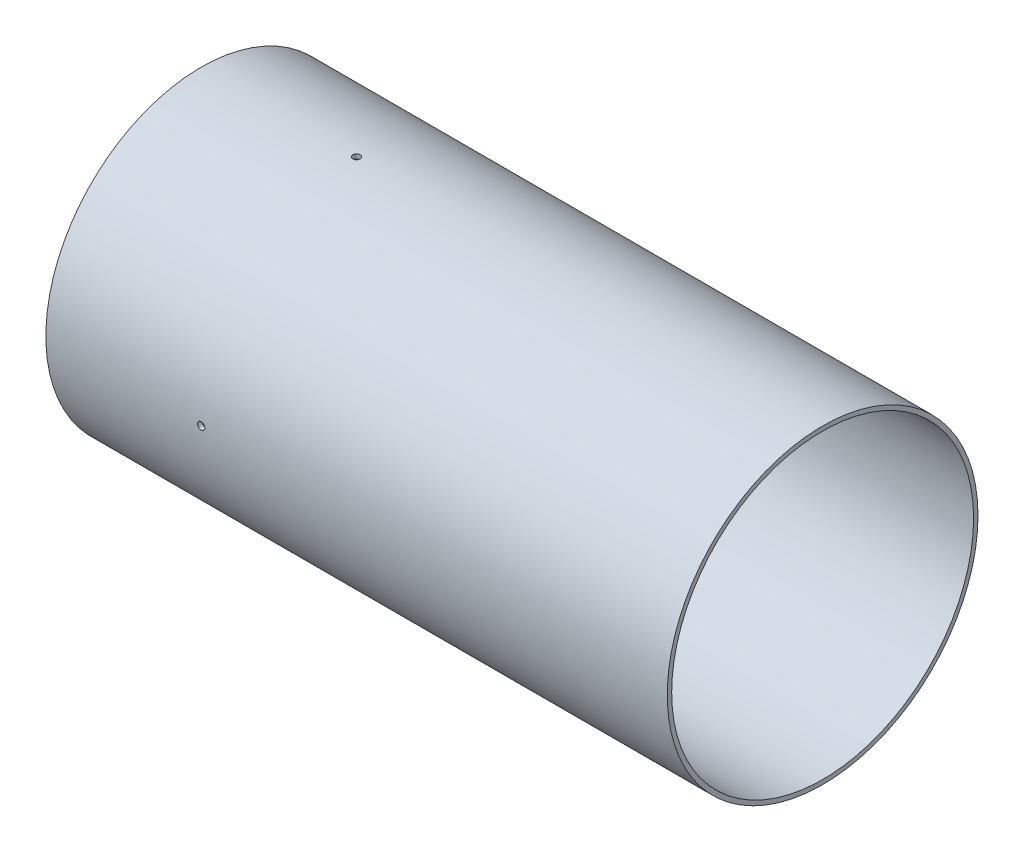
from build123d import *

# Parameters (mm, degrees)
SKETCH1_R               = 76.2
SKETCH1_R_2             = 74.041
BOSS_EXTRUDE1_DEPTH     = 304.8
CUT_EXTRUDE1_REACH      = 325.289
CUT_EXTRUDE1_END_RADIUS = 76.2
SKETCH2_R               = 1.7859375
CIRPATTERN1_COUNT       = 4


with BuildPart() as part:
    # Sketch1 → Boss-Extrude1 (new body)
    with BuildSketch(Plane(origin=(0, 0, 0), x_dir=(0, 0, -1), z_dir=(1, 0, 0))):
        with Locations(Location((0, 0, 0), (0, 0, 180))):
            Circle(SKETCH1_R)
        with Locations(Location((0, 0, 0), (0, 0, 180))):
            Circle(SKETCH1_R_2, mode=Mode.SUBTRACT)
    extrude(amount=BOSS_EXTRUDE1_DEPTH)

    # Cut-Extrude1: up to this cylinder (the profile starts inside it)
    cut_extrude1_end = Plane(origin=(76.2, 0, 0), z_dir=(-1, 0, 0)) * Cylinder(CUT_EXTRUDE1_END_RADIUS, 803.978, mode=Mode.PRIVATE)
    # Sketch2 → Cut-Extrude1 (cut, up to the surface)
    with BuildSketch(Plane.XY, mode=Mode.PRIVATE) as cut_extrude1_sk1:
        with Locations((76.2, 0)):
            Circle(SKETCH2_R)
    cut_extrude1_tool1 = extrude(cut_extrude1_sk1.sketch, amount=-CUT_EXTRUDE1_REACH, mode=Mode.PRIVATE) & cut_extrude1_end
    cut_extrude1 = cut_extrude1_tool1.solids().sort_by_distance((76.2, 0, 0))[0]
    add(cut_extrude1, mode=Mode.SUBTRACT)

    # CirPattern1: Cut-Extrude1 ×4 about axis
    cirpattern1_axis = Axis((0, 0, 0), (1, 0, 0))
    for i in range(1, CIRPATTERN1_COUNT):
        add(cut_extrude1.rotate(cirpattern1_axis, i * 360 / CIRPATTERN1_COUNT), mode=Mode.SUBTRACT)


solid = part.part
